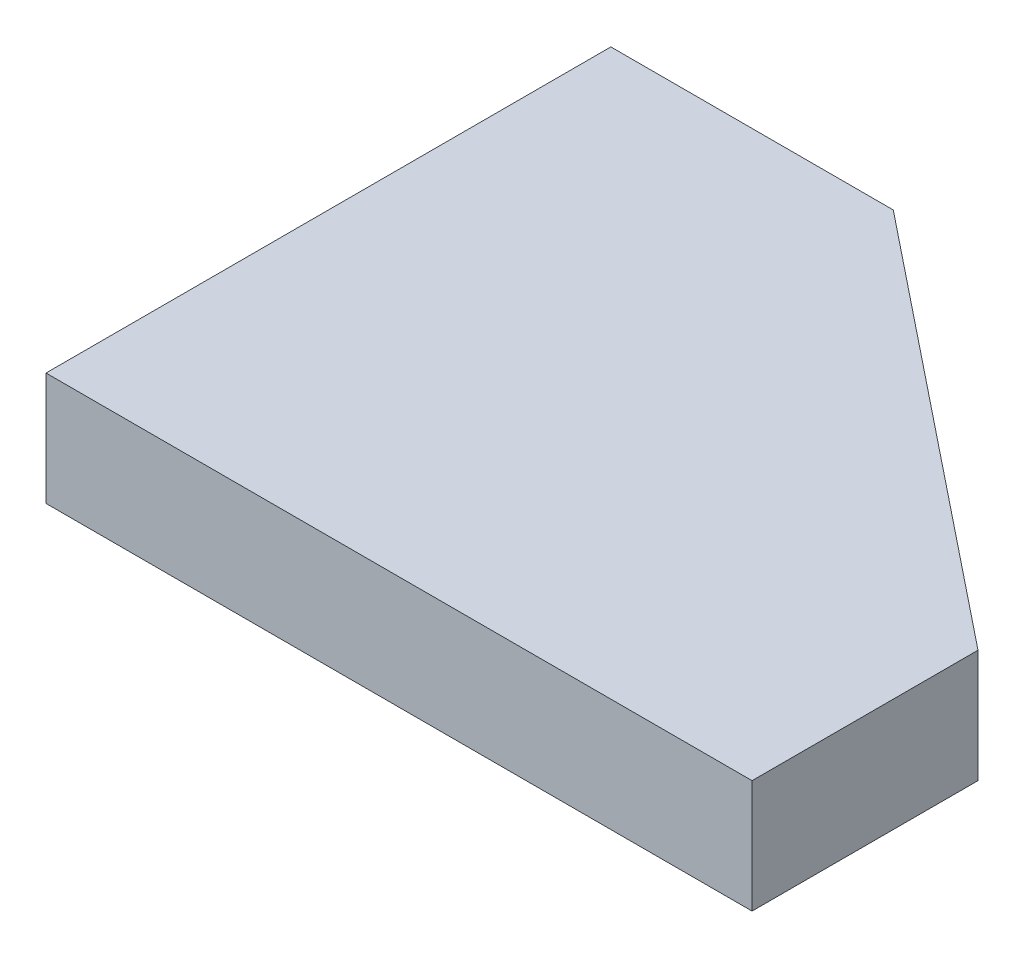
from build123d import *

# Parameters (mm, degrees)
EXTRUDE_1_DEPTH = 4


with BuildPart() as part:
    # Эскиз1 → Вытянуть1 (new body)
    with BuildSketch(Plane(origin=(0, 0, 0), x_dir=(1, 0, 0), z_dir=(0, 1, 0))):
        Polygon((0, 0), (0, 20), (9.999999241, 20), (24.999999987, 8), (24.999999987, 0), align=None)
    extrude(amount=EXTRUDE_1_DEPTH)


solid = part.part
